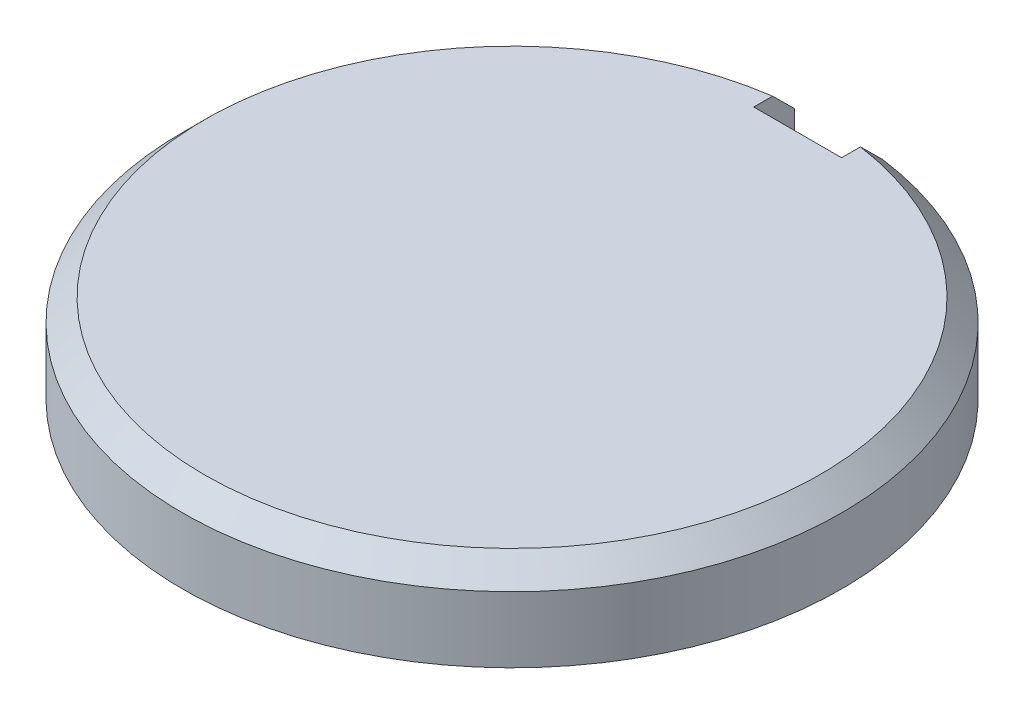
from build123d import *

# Parameters (mm, degrees)
BOSS_EXTRUDE1_START = -65.2
SKETCH2_W           = 0.8
SKETCH2_H           = 1.28
BOSS_EXTRUDE1_DEPTH = 6.4
BOSS_EXTRUDE2_START = -62.4
SKETCH3_W           = 6.4
SKETCH3_H           = 1.28
BOSS_EXTRUDE2_DEPTH = 0.8
BOSS_EXTRUDE3_START = -68.1
SKETCH4_W           = 1.6
SKETCH4_H           = 1.8
BOSS_EXTRUDE3_DEPTH = 0.9


with BuildPart() as part:
    # Sketch1 → Revolve1 (revolve)
    with BuildSketch(Plane.XY.offset(-62), mode=Mode.PRIVATE) as revolve1_sk:
        Polygon((2.3, 49.6), (2.3, 50.6), (0, 50.6), (0, 52.2), (5.6, 52.2), (6, 51.8), (6, 50.6), (3, 50.6), (3, 49.6), align=None)
    revolve(revolve1_sk.sketch.rotate(Axis((0, 44.6, -62), (0, 1, 0)), 90), axis=Axis((0, 44.6, -62), (0, 1, 0)))


with BuildPart() as body_2:
    # Sketch2 → Boss-Extrude1 (new body)
    with BuildSketch(Plane.XY.offset(BOSS_EXTRUDE1_START)):
        with Locations((0, 49.94)):
            Rectangle(SKETCH2_W, SKETCH2_H)
    extrude(amount=BOSS_EXTRUDE1_DEPTH)


with BuildPart() as part_1:
    add(part.part)

    # Combine1: cut body 2
    add(body_2.part, mode=Mode.SUBTRACT)


with BuildPart() as body_2_2:
    # Sketch3 → Boss-Extrude2 (new body)
    with BuildSketch(Plane.XY.offset(BOSS_EXTRUDE2_START)):
        with Locations((0, 49.94)):
            Rectangle(SKETCH3_W, SKETCH3_H)
    extrude(amount=BOSS_EXTRUDE2_DEPTH)


with BuildPart() as part_2:
    add(part_1.part)

    # Combine2: cut body 2 2
    add(body_2_2.part, mode=Mode.SUBTRACT)


with BuildPart() as body_2_3:
    # Sketch4 → Boss-Extrude3 (new body)
    with BuildSketch(Plane.XY.offset(BOSS_EXTRUDE3_START)):
        with Locations((0, 51.4)):
            Rectangle(SKETCH4_W, SKETCH4_H)
    extrude(amount=BOSS_EXTRUDE3_DEPTH)


with BuildPart() as part_3:
    add(part_2.part)

    # Combine3: cut body 2 3
    add(body_2_3.part, mode=Mode.SUBTRACT)


solid = part_3.part
